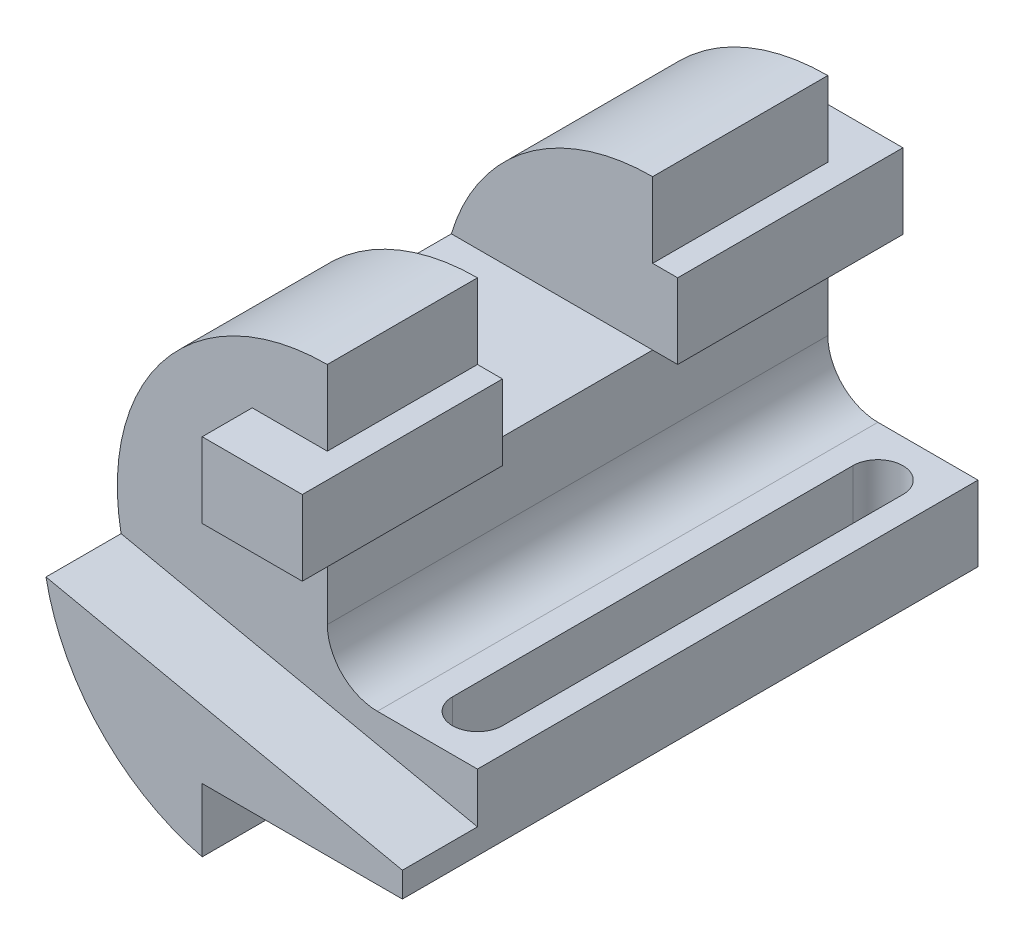
from build123d import *

# Parameters (mm, degrees)
BOSS_EXTRUDE1_DEPTH = 100
SKETCH2_W           = 35
SKETCH2_H           = 30
CUT_EXTRUDE1_DEPTH  = 139.001578957
SKETCH3_W           = 20
SKETCH3_H           = 15
BOSS_EXTRUDE2_DEPTH = 10
SKETCH4_W           = 20
SKETCH4_H           = 15
BOSS_EXTRUDE3_DEPTH = 10
BOSS_EXTRUDE4_DEPTH = 15
CUT_EXTRUDE2_DEPTH  = 134.603892159


with BuildPart() as part:
    # Sketch1 → Boss-Extrude1 (new body)
    with BuildSketch(Plane.XY):
        with BuildLine():
            Line((0, 0), (0, 12.701945525))
            Line((0, 12.701945525), (40, 12.701945525))
            Line((40, 12.701945525), (40, 27.701945525))
            Line((40, 27.701945525), (20, 27.701945525))
            ThreePointArc((20, 27.701945525), (12.928932188, 30.630877713), (10, 37.701945525))
            Line((10, 37.701945525), (10, 52.701945525))
            Line((10, 52.701945525), (15, 52.701945525))
            Line((15, 52.701945525), (15, 67.701945525))
            Line((15, 67.701945525), (10, 67.701945525))
            Line((10, 67.701945525), (10, 82.701945525))
            ThreePointArc((10, 82.701945525), (-31.652166191, 45.782811211), (0, 0))
        make_face()
    extrude(amount=BOSS_EXTRUDE1_DEPTH)

    # Sketch2 → Cut-Extrude1 (cut, through all)
    with BuildSketch(Plane(origin=(15, 0, 0), x_dir=(0, 0, -1), z_dir=(1, 0, 0))):
        with Locations((-52.5, 67.701945525)):
            Rectangle(SKETCH2_W, SKETCH2_H)
    extrude(amount=-CUT_EXTRUDE1_DEPTH, mode=Mode.SUBTRACT)

    # Sketch3 → Boss-Extrude2 (add)
    with BuildSketch(Plane.XY.offset(100)):
        with Locations((5, 60.201945525)):
            Rectangle(SKETCH3_W, SKETCH3_H)
    extrude(amount=BOSS_EXTRUDE2_DEPTH)

    # Sketch4 → Boss-Extrude3 (add)
    with BuildSketch(Plane(origin=(0, 0, 0), x_dir=(-1, 0, 0), z_dir=(0, 0, -1))):
        with Locations((-5, 60.201945525)):
            Rectangle(SKETCH4_W, SKETCH4_H)
    extrude(amount=BOSS_EXTRUDE3_DEPTH)

    # Sketch5 → Boss-Extrude4 (add)
    with BuildSketch(Plane.XY.offset(100)):
        with BuildLine():
            Line((40, 17.701945525), (-31.20321015, 32.836655055))
            ThreePointArc((-31.20321015, 32.836655055), (-20.413872841, 11.845443896), (0, 0))
            Line((0, 0), (0, 12.701945525))
            Line((0, 12.701945525), (40, 12.701945525))
            Line((40, 12.701945525), (40, 17.701945525))
        make_face()
    extrude(amount=BOSS_EXTRUDE4_DEPTH)

    # Sketch6 → Cut-Extrude2 (cut, through all)
    with BuildSketch(Plane(origin=(0, 27.701945525, 0), x_dir=(1, 0, 0), z_dir=(0, 1, 0))):
        with BuildLine():
            Line((35, -10), (35, -90))
            ThreePointArc((35, -90), (30, -95), (25, -90))
            Line((25, -90), (25, -10))
            ThreePointArc((25, -10), (30, -5), (35, -10))
        make_face()
    extrude(amount=-CUT_EXTRUDE2_DEPTH, mode=Mode.SUBTRACT)


solid = part.part
